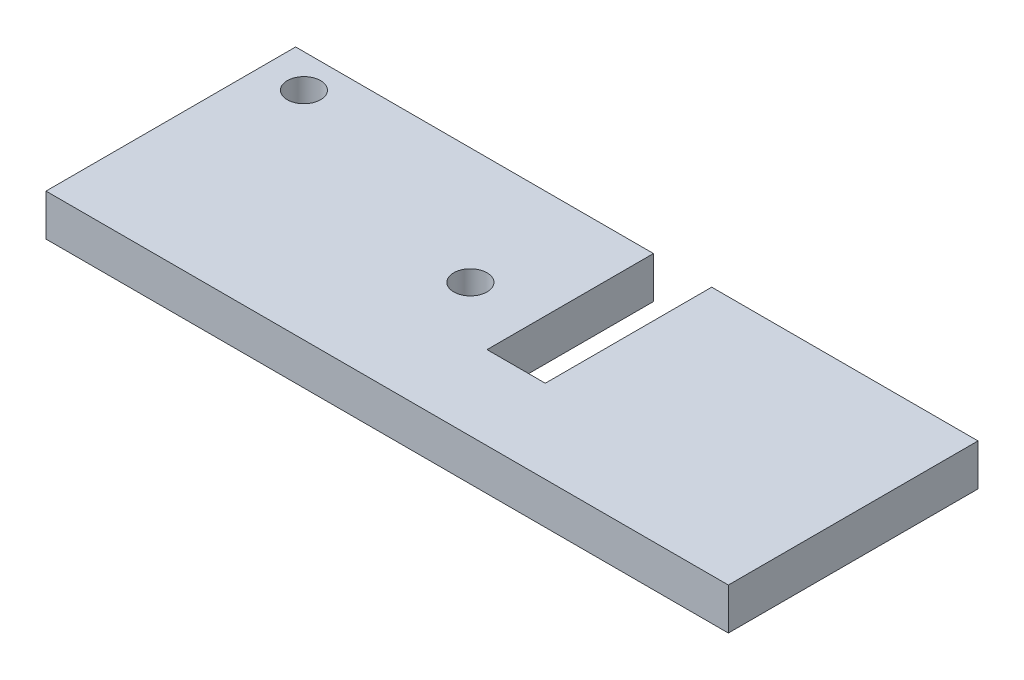
from build123d import *

# Parameters (mm, degrees)
SKETCH1_R           = 2
BOSS_EXTRUDE1_DEPTH = 5


with BuildPart() as part:
    # Sketch1 → Boss-Extrude1 (new body)
    with BuildSketch(Plane(origin=(0, 0, 0), x_dir=(1, 0, 0), z_dir=(0, 1, 0))):
        Polygon((50, 30), (82, 30), (82, 0), (0, 0), (0, 30), (43, 30), (43, 10), (50, 10), align=None)
        with Locations(Location((5, 26, 0), (0, 0, 270))):
            Circle(SKETCH1_R, mode=Mode.SUBTRACT)
        with Locations(Location((35, 16, 0), (0, 0, 270))):
            Circle(SKETCH1_R, mode=Mode.SUBTRACT)
    extrude(amount=-BOSS_EXTRUDE1_DEPTH)


solid = part.part
